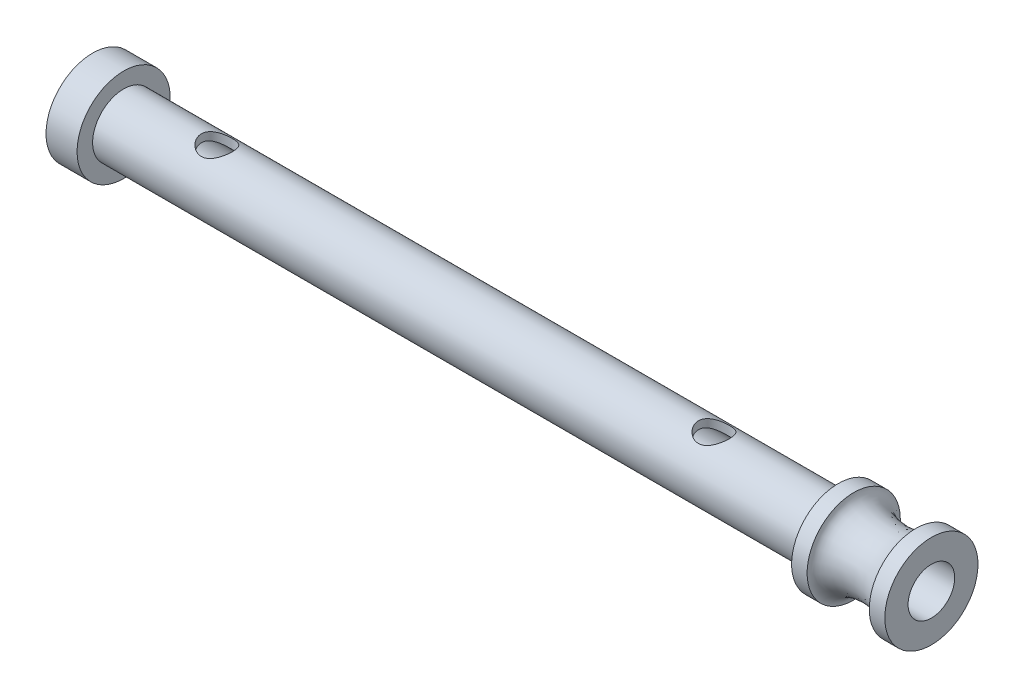
from build123d import *
from build123d.topology import SkipClean

# Parameters (mm, degrees)
CROQUIS1_R                 = 10
CROQUIS1_R_2               = 7.5
SALIENTE_EXTRUIR1_DEPTH    = 130
SALIENTE_EXTRUIR2_START    = 10
CROQUIS2_R                 = 15
CROQUIS2_R_2               = 7.5
SALIENTE_EXTRUIR2_DEPTH    = 10
CORTAR_EXTRUIR1_DEPTH      = 142.598022585
CORTAR_EXTRUIR1_DEPTH_BACK = 142.598022585
CROQUIS3_R                 = 5
CROQUIS4_R                 = 15
CROQUIS4_R_2               = 10
SALIENTE_EXTRUIR3_DEPTH    = 30
CROQUIS5_RX                = 10
CROQUIS5_RY                = 5


with BuildPart() as part:
    # Croquis1 → Saliente-Extruir1 (new, symmetric)
    with BuildSketch(Plane(origin=(0, 0, 0), x_dir=(0, 0, -1), z_dir=(1, 0, 0))):
        Circle(CROQUIS1_R)
        Circle(CROQUIS1_R_2, mode=Mode.SUBTRACT)
    extrude(amount=SALIENTE_EXTRUIR1_DEPTH, both=True)

    # Croquis2 → Saliente-Extruir2 (add)
    with SkipClean():  # the faces are left unmerged after this step: merging them gives an invalid solid
        with BuildSketch(Plane.ZY.offset(130).offset(SALIENTE_EXTRUIR2_START)):
            Circle(CROQUIS2_R)
            Circle(CROQUIS2_R_2, mode=Mode.SUBTRACT)
        extrude(amount=-SALIENTE_EXTRUIR2_DEPTH)

    # Croquis3 → Cortar-Extruir1 (cut, two sides: drawn at the far end of the back side and taken through both)
    with SkipClean():  # the faces are left unmerged after this step: merging them gives an invalid solid
        with BuildSketch(Plane(origin=(0, 0, 0), x_dir=(1, 0, 0), z_dir=(0, 1, 0)).offset(-CORTAR_EXTRUIR1_DEPTH_BACK)):
            with Locations(Location((-100, 0, 0), (0, 0, 270))):
                Circle(CROQUIS3_R)
            with Locations(Location((60, 0, 0), (0, 0, 270))):
                Circle(CROQUIS3_R)
        extrude(amount=CORTAR_EXTRUIR1_DEPTH + CORTAR_EXTRUIR1_DEPTH_BACK, mode=Mode.SUBTRACT)

    # Croquis4 → Saliente-Extruir3 (add)
    with SkipClean():  # the faces are left unmerged after this step: merging them gives an invalid solid
        with BuildSketch(Plane(origin=(130, 0, 0), x_dir=(0, 0, -1), z_dir=(1, 0, 0))):
            with Locations(Location((0, 0, 0), (0, 0, 180))):
                Circle(CROQUIS4_R)
            Circle(CROQUIS4_R_2, mode=Mode.SUBTRACT)
        extrude(amount=-SALIENTE_EXTRUIR3_DEPTH)

    # Croquis5 → Cortar-Revolución1 (revolve, cut)
    with SkipClean():  # the faces are left unmerged after this step: merging them gives an invalid solid
        with BuildSketch(Plane.XY, mode=Mode.PRIVATE) as cortar_revoluci_n1_sk:
            with Locations(Location((115, 15), (0, 0, 180))):
                Ellipse(CROQUIS5_RX, CROQUIS5_RY)
        revolve(cortar_revoluci_n1_sk.sketch.rotate(Axis((130, 0, 0), (-1, 0, 0)), 90), axis=Axis((130, 0, 0), (-1, 0, 0)), mode=Mode.SUBTRACT)


solid = part.part
